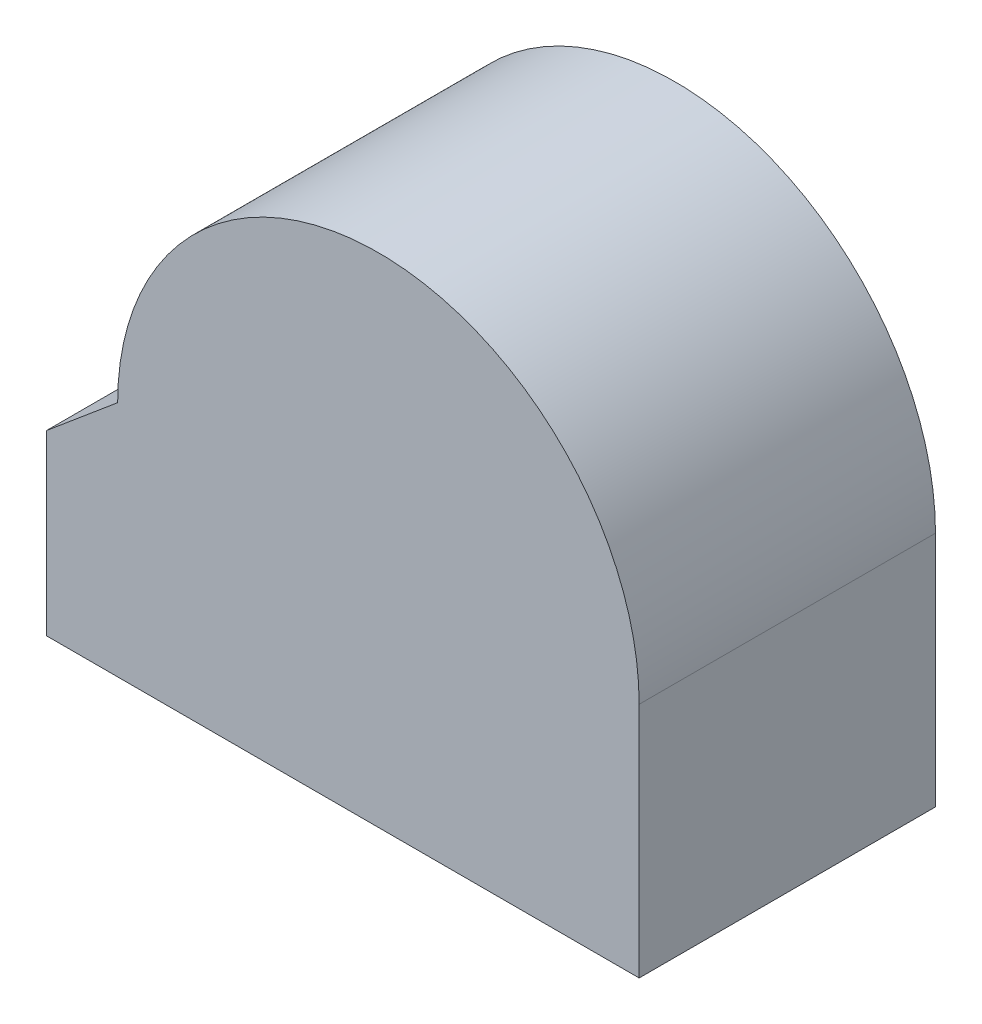
from build123d import *

# Parameters (mm, degrees)
CROQUIS1_W              = 50
CROQUIS1_H              = 25
SALIENTE_EXTRUIR1_DEPTH = 20
SALIENTE_EXTRUIR2_DEPTH = 25
SALIENTE_EXTRUIR3_DEPTH = 2
CROQUIS3_W              = 40
CROQUIS3_H              = 23
CORTAR_EXTRUIR1_DEPTH   = 20
CHAFL_N1_SIZE           = 5
CHAFL_N1_SIZE2          = 5.958767963


with BuildPart() as part:
    # Croquis1 → Saliente-Extruir1 (new body)
    with BuildSketch(Plane(origin=(0, 0, 0), x_dir=(1, 0, 0), z_dir=(0, 1, 0))):
        Rectangle(CROQUIS1_W, CROQUIS1_H)
    extrude(amount=SALIENTE_EXTRUIR1_DEPTH)

    # Croquis2 → Saliente-Extruir2 (add)
    with BuildSketch(Plane.XY.offset(12.5)):
        with BuildLine():
            ThreePointArc((25, 20), (3, 42), (-19, 20))
            Line((-19, 20), (-17, 20))
            ThreePointArc((-17, 20), (3, 40), (23, 20))
            Line((23, 20), (25, 20))
        make_face()
    extrude(amount=-SALIENTE_EXTRUIR2_DEPTH)

    # Croquis2<6> → Saliente-Extruir3 (add)
    with BuildSketch(Plane.XY.offset(12.5)):
        with BuildLine():
            ThreePointArc((23, 20), (3, 40), (-17, 20))
            Line((-17, 20), (23, 20))
        make_face()
    extrude(amount=-SALIENTE_EXTRUIR3_DEPTH)

    # Croquis3 → Cortar-Extruir1 (cut)
    with BuildSketch(Plane(origin=(0, 20, 0), x_dir=(1, 0, 0), z_dir=(0, 1, 0))):
        with Locations((3, 1)):
            Rectangle(CROQUIS3_W, CROQUIS3_H)
    extrude(amount=-CORTAR_EXTRUIR1_DEPTH, mode=Mode.SUBTRACT)

    # Chaflán1
    chafl_n1_edges = [part.edges().sort_by_distance(p)[0] for p in [
        (-25, 20, 0),
    ]]
    chafl_n1_side = [part.faces().sort_by_distance(p)[0] for p in [
        (-25, 10, 0),
    ]]
    chamfer(chafl_n1_edges, length=CHAFL_N1_SIZE, length2=CHAFL_N1_SIZE2, reference=chafl_n1_side[0])


solid = part.part
